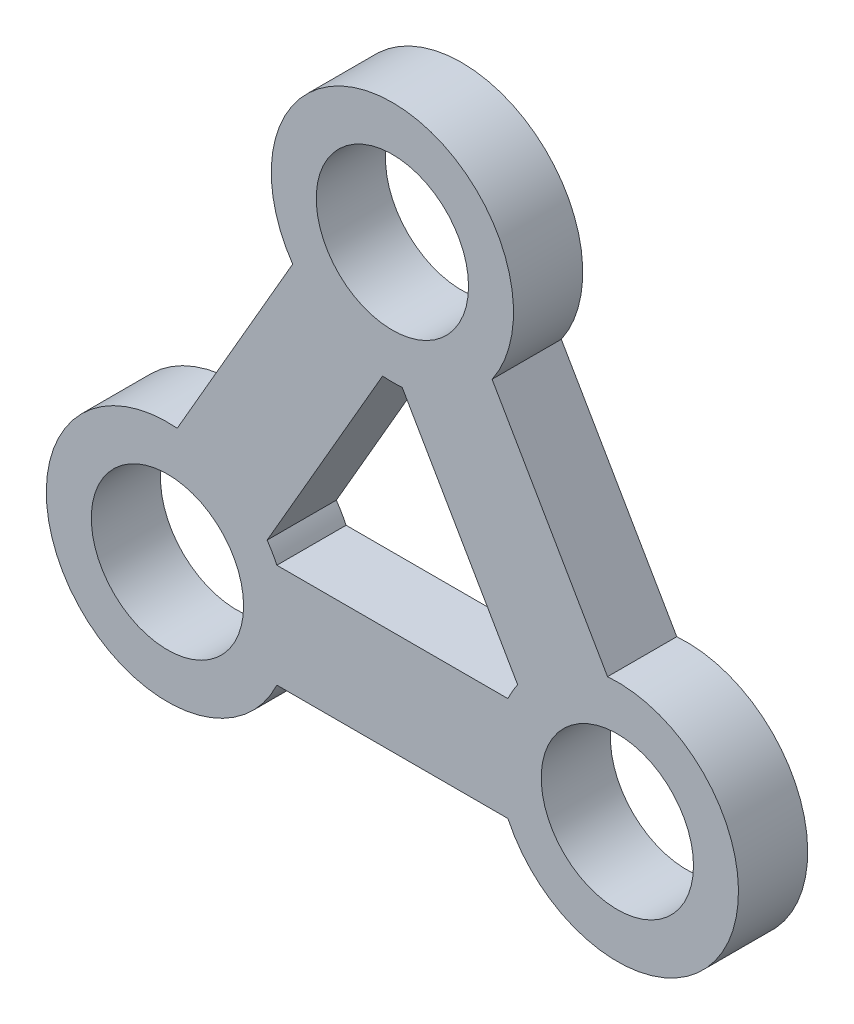
from build123d import *

# Parameters (mm, degrees)
SKETCH1_R           = 22
BOSS_EXTRUDE1_DEPTH = 20


with BuildPart() as part:
    # Sketch1 → Boss-Extrude1 (new body)
    with BuildSketch(Plane.XY):
        with BuildLine():
            Line((-33.377223398, -15), (33.377223398, -15))
            ThreePointArc((33.377223398, -15), (95.313693749, -17.495141363), (62.167809382, 34.885221747))
            Line((62.167809382, 34.885221747), (28.808142815, 92.62310619))
            ThreePointArc((28.808142815, 92.62310619), (0, 147.5), (-28.808142815, 92.62310619))
            Line((-28.808142815, 92.62310619), (-62.167809382, 34.885221747))
            ThreePointArc((-62.167809382, 34.885221747), (-95.313693749, -17.495141363), (-33.377223398, -15))
        make_face()
        with Locations((0, 112.5)):
            Circle(SKETCH1_R, mode=Mode.SUBTRACT)
        with Locations((65, 0)):
            Circle(SKETCH1_R, mode=Mode.SUBTRACT)
        with Locations((-65, 0)):
            Circle(SKETCH1_R, mode=Mode.SUBTRACT)
        with BuildLine():
            Line((-33.377223398, 15), (33.377223398, 15))
            ThreePointArc((33.377223398, 15), (34.686306251, 17.495141363), (36.191857185, 19.87689381))
            Line((36.191857185, 19.87689381), (2.832190618, 77.614778253))
            ThreePointArc((2.832190618, 77.614778253), (0, 77.5), (-2.832190618, 77.614778253))
            Line((-2.832190618, 77.614778253), (-36.191857185, 19.87689381))
            ThreePointArc((-36.191857185, 19.87689381), (-34.686306251, 17.495141363), (-33.377223398, 15))
        make_face(mode=Mode.SUBTRACT)
    extrude(amount=BOSS_EXTRUDE1_DEPTH)


solid = part.part
